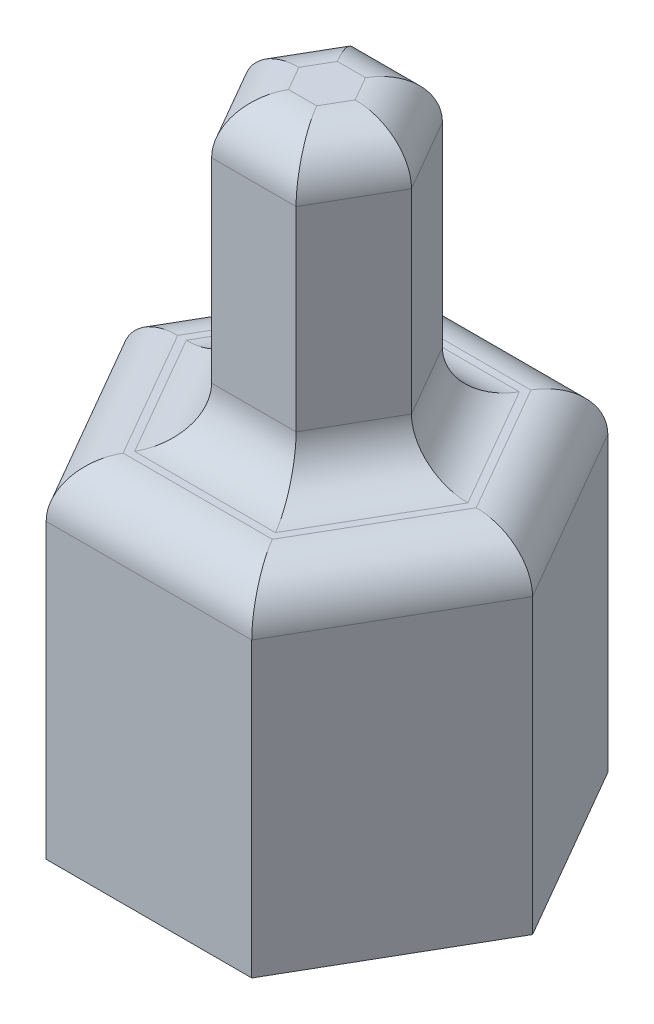
from build123d import *

# Parameters (mm, degrees)
BOSS_EXTRUDE1_DEPTH = 15.24
BOSS_EXTRUDE2_DEPTH = 2.54
BOSS_EXTRUDE3_DEPTH = 15.24
CUT_EXTRUDE3_DEPTH  = 15.24
FILLET9_R           = 2.54
CUT_EXTRUDE4_DEPTH  = 15.24
FILLET1_R           = 2.54


with BuildPart() as part:
    # Sketch1 → Boss-Extrude1 (new body)
    with BuildSketch(Plane(origin=(0, 0, 0), x_dir=(1, 0, 0), z_dir=(0, 1, 0))):
        Polygon((10.705228691, 0), (5.352614346, 9.271), (-5.352614346, 9.271), (-10.705228691, 0), (-5.352614346, -9.271), (5.352614346, -9.271), align=None)
        Polygon((7.772289324, 0), (3.886144662, 6.731), (-3.886144662, 6.731), (-7.772289324, 0), (-3.886144662, -6.731), (3.886144662, -6.731), align=None, mode=Mode.SUBTRACT)
    extrude(amount=BOSS_EXTRUDE1_DEPTH)

    # Sketch2 → Boss-Extrude2 (add)
    with BuildSketch(Plane(origin=(0, 15.24, 0), x_dir=(1, 0, 0), z_dir=(0, 1, 0))):
        Polygon((10.705228691, 0), (5.352614346, 9.271), (-5.352614346, 9.271), (-10.705228691, 0), (-5.352614346, -9.271), (5.352614346, -9.271), align=None)
    extrude(amount=BOSS_EXTRUDE2_DEPTH)

    # Sketch3 → Boss-Extrude3 (add)
    with BuildSketch(Plane(origin=(0, 17.78, 0), x_dir=(1, 0, 0), z_dir=(0, 1, 0))):
        Polygon((4.399409051, 0), (2.199704526, 3.81), (-2.199704526, 3.81), (-4.399409051, 0), (-2.199704526, -3.81), (2.199704526, -3.81), align=None)
    extrude(amount=BOSS_EXTRUDE3_DEPTH)

    # Sketch8 → Cut-Extrude3 (cut)
    with BuildSketch(Plane.XZ):
        with BuildLine():
            Line((3.886144662, 6.731), (7.772289324, 0))
            add(Edge.make_bspline(
                [(3.886144662, 6.731), (7.588980613, 4.3815), (7.772289324, 0)],
                knots=[0, 0, 0, 1, 1, 1], degree=2))
        make_face()
    extrude(amount=-CUT_EXTRUDE3_DEPTH, mode=Mode.SUBTRACT)

    # Fillet9
    fillet9_edges = [part.edges().sort_by_distance(p)[0] for p in [
        (3.299556788, 17.78, 1.905),
        (3.299556788, 17.78, -1.905),
        (0, 17.78, -3.81),
        (-3.299556788, 17.78, -1.905),
        (-3.299556788, 17.78, 1.905),
        (0, 17.78, 3.81),
        (3.299556788, 33.02, 1.905),
        (3.299556788, 33.02, -1.905),
        (0, 33.02, -3.81),
        (-3.299556788, 33.02, -1.905),
        (-3.299556788, 33.02, 1.905),
        (0, 33.02, 3.81),
    ]]
    fillet(fillet9_edges, radius=FILLET9_R)

    # Sketch9 → Cut-Extrude4 (cut)
    with BuildSketch(Plane.XZ):
        with BuildLine():
            Line((-7.772289324, 0), (-3.886144662, -6.731))
            add(Edge.make_bspline(
                [(-7.772289324, 0), (-7.588980613, -4.3815), (-3.886144662, -6.731)],
                knots=[0, 0, 0, 1, 1, 1], degree=2))
        make_face()
    extrude(amount=-CUT_EXTRUDE4_DEPTH, mode=Mode.SUBTRACT)

    # Fillet1
    fillet1_edges = [part.edges().sort_by_distance(p)[0] for p in [
        (8.028921518, 17.78, 4.6355),
        (8.028921518, 17.78, -4.6355),
        (0, 17.78, -9.271),
        (-8.028921518, 17.78, -4.6355),
        (-8.028921518, 17.78, 4.6355),
        (0, 17.78, 9.271),
    ]]
    fillet(fillet1_edges, radius=FILLET1_R)


solid = part.part
